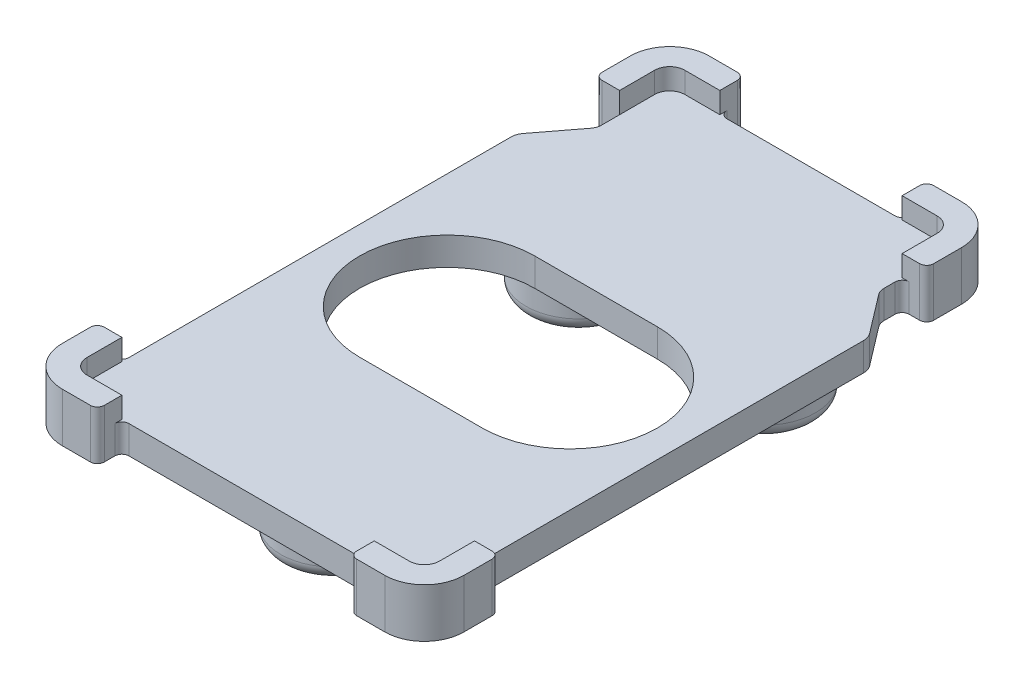
from build123d import *

# Parameters (mm, degrees)
SALIENTE_EXTRUIR1_DEPTH  = 4
SALIENTE_EXTRUIR2_DEPTH  = 7
REDONDEO1_R              = 1
CROQUIS3_R               = 7.5
CROQUIS3_R_2             = 3
SALIENTE_EXTRUIR3_DEPTH  = 8
CROQUIS3_3_R             = 7.5
CROQUIS3_3_R_2           = 3
SALIENTE_EXTRUIR4_DEPTH  = 8
REDONDEO2_R              = 2
REDONDEO3_R              = 2
REDONDEO3_OF_SIMETR_A1_R = 2
CORTAR_EXTRUIR1_REACH    = 90.781


with BuildPart() as part:
    # Croquis2 → Saliente-Extruir1 (new body)
    with BuildSketch(Plane(origin=(0, 0, 0), x_dir=(1, 0, 0), z_dir=(0, 1, 0))):
        with BuildLine():
            Line((-20.528478505, 69.291218974), (-24.710152383, 63.803020924))
            ThreePointArc((-24.710152383, 63.803020924), (-25.037074331, 63.187623562), (-25.150002674, 62.49999062))
            Line((-25.150002674, 62.49999062), (-25.150002674, 7))
            Line((-25.150002674, 7), (-25.150002674, 2))
            ThreePointArc((-25.150002674, 2), (-24.520282253, 0.47972042), (-23.000002674, -0.15))
            Line((-23.000002674, -0.15), (-18.000002674, -0.15))
            Line((-18.000002674, -0.15), (-6.000002674, -0.15))
            Line((-6.000002674, -0.15), (6.000002674, -0.15))
            Line((6.000002674, -0.15), (18.000002674, -0.15))
            Line((18.000002674, -0.15), (23.000002674, -0.15))
            ThreePointArc((23.000002674, -0.15), (24.520282253, 0.47972042), (25.150002674, 2))
            Line((25.150002674, 2), (25.150002674, 7))
            Line((25.150002674, 7), (25.150002674, 62.49999062))
            ThreePointArc((25.150002674, 62.49999062), (25.037074331, 63.187623562), (24.710152383, 63.803020924))
            Line((24.710152383, 63.803020924), (20.528478505, 69.291218974))
            ThreePointArc((20.528478505, 69.291218974), (20.247173573, 69.820746936), (20.150002674, 70.412431095))
            Line((20.150002674, 70.412431095), (20.150002674, 72.999990621))
            Line((20.150002674, 72.999990621), (20.150002674, 77.999990621))
            ThreePointArc((20.150002674, 77.999990621), (19.520282253, 79.5202702), (18.000002674, 80.149990621))
            Line((18.000002674, 80.149990621), (13.000002674, 80.149990621))
            Line((13.000002674, 80.149990621), (6.000002674, 80.149990621))
            Line((6.000002674, 80.149990621), (-6.000002674, 80.149990621))
            Line((-6.000002674, 80.149990621), (-13.000002674, 80.149990621))
            Line((-13.000002674, 80.149990621), (-18.000002674, 80.149990621))
            ThreePointArc((-18.000002674, 80.149990621), (-19.520282253, 79.5202702), (-20.150002674, 77.999990621))
            Line((-20.150002674, 77.999990621), (-20.150002674, 72.999990621))
            Line((-20.150002674, 72.999990621), (-20.150002674, 70.412431095))
            ThreePointArc((-20.150002674, 70.412431095), (-20.247173573, 69.820746936), (-20.528478505, 69.291218974))
        make_face()
    extrude(amount=SALIENTE_EXTRUIR1_DEPTH)

    # Croquis2<3> → Saliente-Extruir2 (add)
    with BuildSketch(Plane(origin=(0, 0, 0), x_dir=(1, 0, 0), z_dir=(0, 1, 0))):
        with BuildLine():
            Line((-25.150002674, 2), (-25.150002674, 7))
            Line((-25.150002674, 7), (-28.650002674, 7))
            Line((-28.650002674, 7), (-28.650002674, 2))
            ThreePointArc((-28.650002674, 2), (-26.995155987, -1.995153314), (-23.000002674, -3.65))
            Line((-23.000002674, -3.65), (-18.000002674, -3.65))
            Line((-18.000002674, -3.65), (-18.000002674, -0.15))
            Line((-18.000002674, -0.15), (-23.000002674, -0.15))
            ThreePointArc((-23.000002674, -0.15), (-24.520282253, 0.47972042), (-25.150002674, 2))
        make_face()
        with BuildLine():
            Line((-23.650002674, 72.999990621), (-20.150002674, 72.999990621))
            Line((-20.150002674, 72.999990621), (-20.150002674, 77.999990621))
            ThreePointArc((-20.150002674, 77.999990621), (-19.520282253, 79.5202702), (-18.000002674, 80.149990621))
            Line((-18.000002674, 80.149990621), (-13.000002674, 80.149990621))
            Line((-13.000002674, 80.149990621), (-13.000002674, 83.649990621))
            Line((-13.000002674, 83.649990621), (-18.000002674, 83.649990621))
            ThreePointArc((-18.000002674, 83.649990621), (-21.995155987, 81.995143934), (-23.650002674, 77.999990621))
            Line((-23.650002674, 77.999990621), (-23.650002674, 72.999990621))
        make_face()
        with BuildLine():
            Line((23.000002674, -0.15), (18.000002674, -0.15))
            Line((18.000002674, -0.15), (18.000002674, -3.65))
            Line((18.000002674, -3.65), (23.000002674, -3.65))
            ThreePointArc((23.000002674, -3.65), (26.995155987, -1.995153314), (28.650002674, 2))
            Line((28.650002674, 2), (28.650002674, 7))
            Line((28.650002674, 7), (25.150002674, 7))
            Line((25.150002674, 7), (25.150002674, 2))
            ThreePointArc((25.150002674, 2), (24.520282253, 0.47972042), (23.000002674, -0.15))
        make_face()
        with BuildLine():
            Line((13.000002674, 83.649990621), (13.000002674, 80.149990621))
            Line((13.000002674, 80.149990621), (18.000002674, 80.149990621))
            ThreePointArc((18.000002674, 80.149990621), (19.520282253, 79.5202702), (20.150002674, 77.999990621))
            Line((20.150002674, 77.999990621), (20.150002674, 72.999990621))
            Line((20.150002674, 72.999990621), (23.650002674, 72.999990621))
            Line((23.650002674, 72.999990621), (23.650002674, 77.999990621))
            ThreePointArc((23.650002674, 77.999990621), (21.995155987, 81.995143934), (18.000002674, 83.649990621))
            Line((18.000002674, 83.649990621), (13.000002674, 83.649990621))
        make_face()
    extrude(amount=SALIENTE_EXTRUIR2_DEPTH)

    # Redondeo1
    redondeo1_edges = [part.edges().sort_by_distance(p)[0] for p in [
        (23.650002674, 3.5, -72.999990621),
        (20.150002674, 2, -72.999990621),
        (13.000002674, 3.5, -83.649990621),
        (13.000002674, 2, -80.149990621),
        (18.000002674, 3.5, 3.65),
        (18.000002674, 2, 0.15),
        (25.150002674, 2, -7),
        (28.650002674, 3.5, -7),
        (-18.000002674, 3.5, 3.65),
        (-18.000002674, 2, 0.15),
        (-28.650002674, 3.5, -7),
        (-25.150002674, 2, -7),
        (-13.000002674, 3.5, -83.649990621),
        (-13.000002674, 2, -80.149990621),
        (-23.650002674, 3.5, -72.999990621),
    ]]
    fillet(redondeo1_edges, radius=REDONDEO1_R)

    # Croquis3 → Saliente-Extruir3 (add)
    with BuildSketch(Plane.XZ):
        with Locations((0, -12)):
            Circle(CROQUIS3_R)
        with Locations((0, -12)):
            Circle(CROQUIS3_R_2, mode=Mode.SUBTRACT)
    extrude(amount=SALIENTE_EXTRUIR3_DEPTH)

    # Croquis3<3> → Saliente-Extruir4 (add)
    with BuildSketch(Plane.XZ):
        with Locations((-13.150002674, -60.149990621)):
            Circle(CROQUIS3_3_R)
        with Locations((-13.150002674, -60.149990621)):
            Circle(CROQUIS3_3_R_2, mode=Mode.SUBTRACT)
    saliente_extruir4 = extrude(amount=SALIENTE_EXTRUIR4_DEPTH)

    # Croquis4 → Cortar-Revolución1 (revolve, cut)
    with BuildSketch(Plane.XY.offset(-12)):
        with BuildLine():
            Line((5.125, -5.5), (-5.125, -5.5))
            ThreePointArc((-5.125, -5.5), (0, -10.625), (5.125, -5.5))
        make_face()
    revolve(axis=Axis((5.125, -5.5, -12), (-1, 0, 0)), mode=Mode.SUBTRACT)

    # Croquis5 → Cortar-Revolución2 (revolve, cut)
    with BuildSketch(Plane.XY.offset(-60.149990621)):
        with BuildLine():
            Line((-8.025002674, -5.5), (-18.275002674, -5.5))
            ThreePointArc((-18.275002674, -5.5), (-13.150002674, -10.625), (-8.025002674, -5.5))
        make_face()
    cortar_revoluci_n2 = revolve(axis=Axis((-8.025002674, -5.5, -60.149990621), (-1, 0, 0)), mode=Mode.SUBTRACT)

    # Redondeo2
    redondeo2_edges = [part.edges().sort_by_distance(p)[0] for p in [
        (-7.5, -8, -12),
        (-7.5, 0, -12),
    ]]
    fillet(redondeo2_edges, radius=REDONDEO2_R)

    # Redondeo3
    redondeo3_edges = [part.edges().sort_by_distance(p)[0] for p in [
        (-20.650002674, -8, -60.149990621),
        (-20.650002674, 0, -60.149990621),
    ]]
    fillet(redondeo3_edges, radius=REDONDEO3_R)

    # Simetría1: Saliente-Extruir4, Cortar-Revolución2 across plane
    add(saliente_extruir4.mirror(Plane(origin=(0, 0, 0), x_dir=(0, 0, 1), z_dir=(1, 0, 0))))
    add(cortar_revoluci_n2.mirror(Plane(origin=(0, 0, 0), x_dir=(0, 0, 1), z_dir=(1, 0, 0))), mode=Mode.SUBTRACT)

    # Redondeo3 of Simetría1
    redondeo3_of_simetr_a1_edges = [part.edges().sort_by_distance(p)[0] for p in [
        (20.650002674, -8, -60.149990621),
        (20.650002674, 0, -60.149990621),
    ]]
    fillet(redondeo3_of_simetr_a1_edges, radius=REDONDEO3_OF_SIMETR_A1_R)

    # Croquis6 → Cortar-Extruir1 (cut, up to next)
    with BuildSketch(Plane.XZ, mode=Mode.PRIVATE) as cortar_extruir1_sk1:
        with BuildLine():
            Line((-8.75, -24.5), (8.75, -24.5))
            ThreePointArc((8.75, -24.5), (21.25, -37), (8.75, -49.5))
            Line((8.75, -49.5), (-8.75, -49.5))
            ThreePointArc((-8.75, -49.5), (-21.25, -37), (-8.75, -24.5))
        make_face()
    cortar_extruir1_tool1 = extrude(cortar_extruir1_sk1.sketch, amount=-CORTAR_EXTRUIR1_REACH, mode=Mode.PRIVATE) & part.part
    add(cortar_extruir1_tool1.solids().sort_by_distance((0, 0, -37))[0], mode=Mode.SUBTRACT)


solid = part.part
